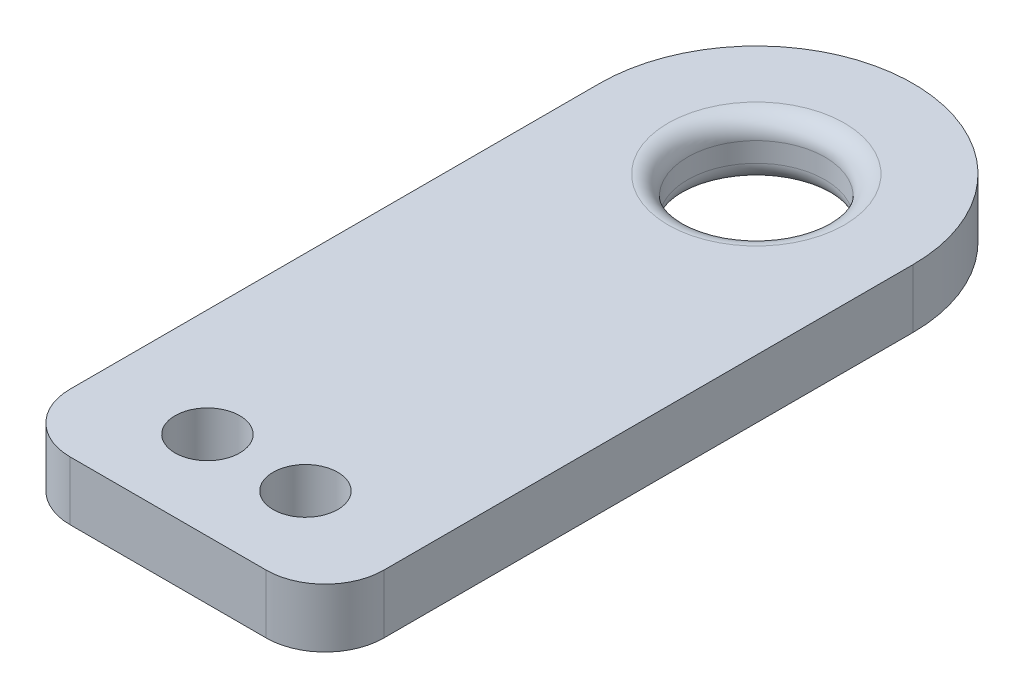
from build123d import *

# Parameters (mm, degrees)
BOSS_EXTRUDE1_DEPTH      = 1.5
BOSS_EXTRUDE1_DEPTH_BACK = 1.5
SKETCH2_R                = 8
SKETCH3_W                = 16
SKETCH3_H                = 30
BOSS_EXTRUDE2_DEPTH      = 1.5
CUT_EXTRUDE1_REACH       = 33.193
SKETCH4_R                = 1.65
CUT_EXTRUDE2_REACH       = 33.193
SKETCH5_R                = 3.5
FILLET1_R                = 1
FILLET2_R                = 3


with BuildPart() as part:
    # Sketch2 → Boss-Extrude1 (new, two sides: drawn at the far end of the back side and taken through both)
    with BuildSketch(Plane(origin=(0, 0, 0), x_dir=(1, 0, 0), z_dir=(0, 1, 0)).offset(-BOSS_EXTRUDE1_DEPTH_BACK)):
        Circle(SKETCH2_R)
    extrude(amount=BOSS_EXTRUDE1_DEPTH + BOSS_EXTRUDE1_DEPTH_BACK)

    # Sketch3 → Boss-Extrude2 (add, symmetric)
    with BuildSketch(Plane(origin=(0, 0, 0), x_dir=(1, 0, 0), z_dir=(0, 1, 0))):
        with Locations((0, -15)):
            Rectangle(SKETCH3_W, SKETCH3_H)
    extrude(amount=BOSS_EXTRUDE2_DEPTH, both=True)

    # Sketch4 → Cut-Extrude1 (cut, up to next)
    with BuildSketch(Plane(origin=(0, 1.5, 0), x_dir=(1, 0, 0), z_dir=(0, 1, 0)), mode=Mode.PRIVATE) as cut_extrude1_sk1:
        with Locations((2.5, -25.5)):
            Circle(SKETCH4_R)
    cut_extrude1_tool1 = extrude(cut_extrude1_sk1.sketch, amount=-CUT_EXTRUDE1_REACH, mode=Mode.PRIVATE) & part.part
    # Sketch4 → Cut-Extrude1 (cut, up to next)
    with BuildSketch(Plane(origin=(0, 1.5, 0), x_dir=(1, 0, 0), z_dir=(0, 1, 0)), mode=Mode.PRIVATE) as cut_extrude1_sk2:
        with Locations((-2.5, -25.5)):
            Circle(SKETCH4_R)
    cut_extrude1_tool2 = extrude(cut_extrude1_sk2.sketch, amount=-CUT_EXTRUDE1_REACH, mode=Mode.PRIVATE) & part.part
    add(cut_extrude1_tool1.solids().sort_by_distance((2.5, 1.5, 25.5))[0], mode=Mode.SUBTRACT)
    add(cut_extrude1_tool2.solids().sort_by_distance((-2.5, 1.5, 25.5))[0], mode=Mode.SUBTRACT)

    # Sketch5 → Cut-Extrude2 (cut, up to next)
    with BuildSketch(Plane.XZ.offset(1.5), mode=Mode.PRIVATE) as cut_extrude2_sk1:
        Circle(SKETCH5_R)
    cut_extrude2_tool1 = extrude(cut_extrude2_sk1.sketch, amount=-CUT_EXTRUDE2_REACH, mode=Mode.PRIVATE) & part.part
    add(cut_extrude2_tool1.solids().sort_by_distance((0, -1.5, 0))[0], mode=Mode.SUBTRACT)

    # Fillet1
    fillet1_edges = [part.edges().sort_by_distance(p)[0] for p in [
        (-3.5, 1.5, 0),
        (-3.5, -1.5, 0),
    ]]
    fillet(fillet1_edges, radius=FILLET1_R)

    # Fillet2
    fillet2_edges = [part.edges().sort_by_distance(p)[0] for p in [
        (-8, 0, 30),
        (8, 0, 30),
    ]]
    fillet(fillet2_edges, radius=FILLET2_R)


solid = part.part
